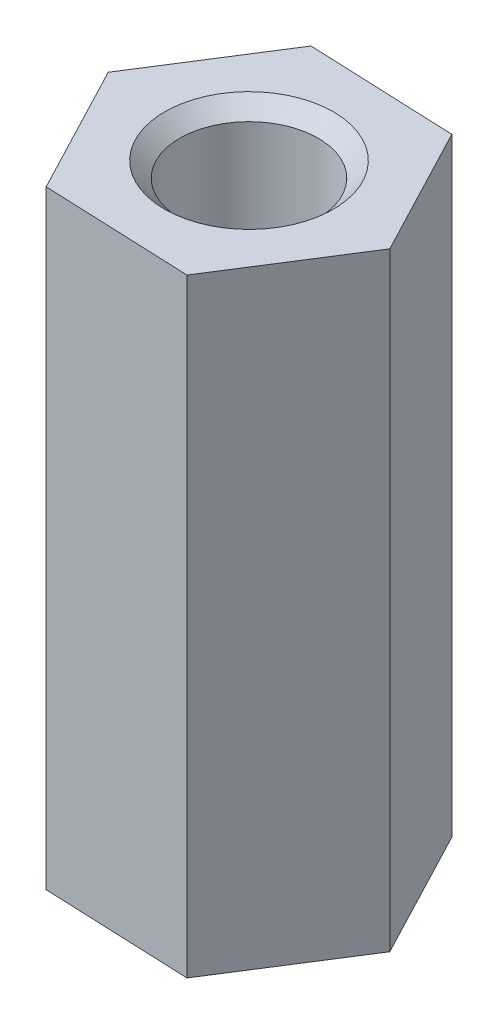
from build123d import *

# Parameters (mm, degrees)
SKETCH_1_R                   = 1.1
EXTRUDE_1_DEPTH              = 11
HOLE_WIZARD_M3_2_D           = 2.5
HOLE_WIZARD_M3_2_CSINK_D     = 3.05
HOLE_WIZARD_M3_2_CSINK_ANGLE = 90


with BuildPart() as part:
    # 草图1 → 凸台-拉伸1 (new body)
    with BuildSketch(Plane(origin=(0, 0, 0), x_dir=(1, 0, 0), z_dir=(0, 1, 0))):
        Polygon((1.231724884, -2.352910356), (2.653542583, -0.109750138), (1.421817699, 2.243160218), (-1.231724884, 2.352910356), (-2.653542583, 0.109750138), (-1.421817699, -2.243160218), align=None)
        with Locations(Location((0, 0, 0), (0, 0, 270))):
            Circle(SKETCH_1_R, mode=Mode.SUBTRACT)
    extrude(amount=EXTRUDE_1_DEPTH)

    # M3 螺纹孔2 (through all)
    with Locations(Plane(origin=(0, 11, 0), x_dir=(1, 0, 0), z_dir=(0, 1, 0))):
        with Locations((0, 0)):
            CounterSinkHole(HOLE_WIZARD_M3_2_D / 2, HOLE_WIZARD_M3_2_CSINK_D / 2, counter_sink_angle=HOLE_WIZARD_M3_2_CSINK_ANGLE)


solid = part.part
